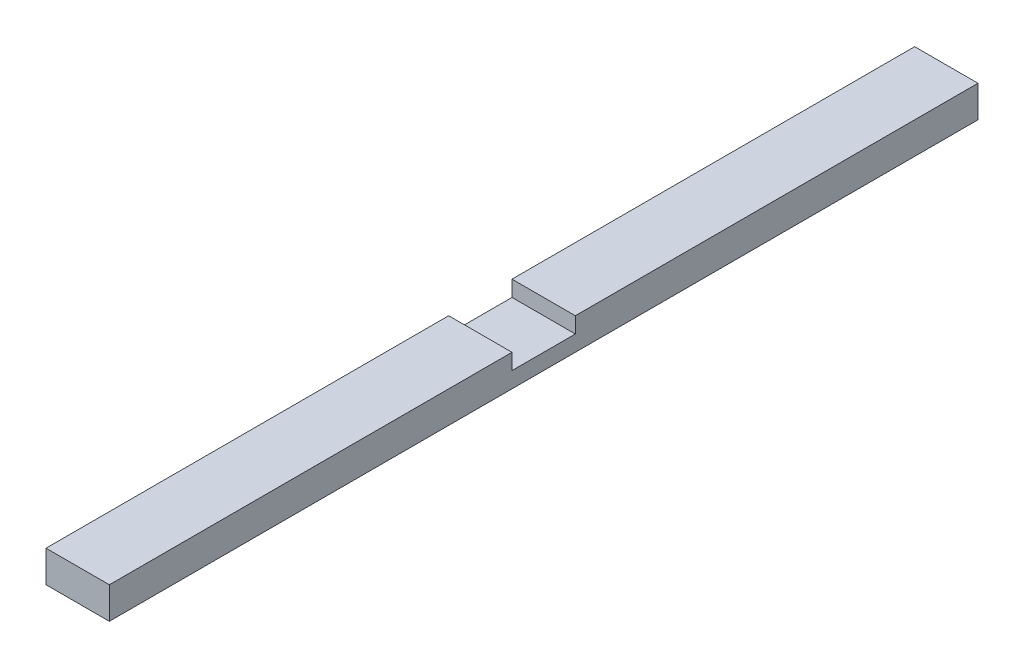
from build123d import *

# Parameters (mm, degrees)
SKETCH1_W           = 88.9
SKETCH1_H           = 44.45
BOSS_EXTRUDE1_DEPTH = 1219.2
SKETCH2_W           = 88.9
SKETCH2_H           = 88.9
CUT_EXTRUDE1_DEPTH  = 22.225


with BuildPart() as part:
    # Sketch1 → Boss-Extrude1 (new body)
    with BuildSketch(Plane.XY):
        Rectangle(SKETCH1_W, SKETCH1_H)
    extrude(amount=BOSS_EXTRUDE1_DEPTH)

    # Sketch2 → Cut-Extrude1 (cut)
    with BuildSketch(Plane(origin=(0, 22.225, 0), x_dir=(1, 0, 0), z_dir=(0, 1, 0))):
        with Locations((0, -609.6)):
            Rectangle(SKETCH2_W, SKETCH2_H)
    extrude(amount=-CUT_EXTRUDE1_DEPTH, mode=Mode.SUBTRACT)


solid = part.part
